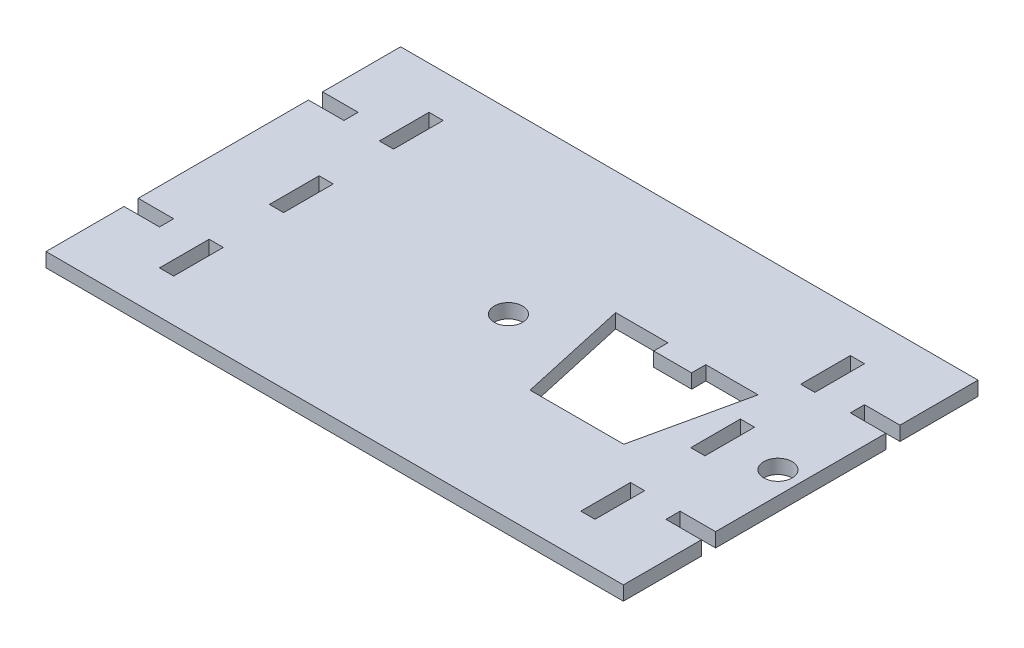
from build123d import *

# Parameters (mm, degrees)
SKETCH2_W           = 100
SKETCH2_H           = 50
BOSS_EXTRUDE1_DEPTH = 2
SKETCH12_W          = 9.8
SKETCH12_H          = 50
SKETCH12_W_2        = 8.8
CUT_EXTRUDE8_DEPTH  = 6
SKETCH13_W          = 2
SKETCH13_H          = 7
SKETCH13_W_2        = 5
SKETCH13_H_2        = 2
CUT_EXTRUDE10_DEPTH = 6
SKETCH14_R          = 2
CUT_EXTRUDE11_DEPTH = 2


with BuildPart() as part:
    # Sketch2 → Boss-Extrude1 (new body)
    with BuildSketch(Plane(origin=(0, 0, 0), x_dir=(1, 0, 0), z_dir=(0, 1, 0))):
        Rectangle(SKETCH2_W, SKETCH2_H)
    extrude(amount=BOSS_EXTRUDE1_DEPTH)

    # Sketch12 → Cut-Extrude8 (cut)
    with BuildSketch(Plane(origin=(0, 2, 0), x_dir=(1, 0, 0), z_dir=(0, 1, 0))):
        with Locations((-45.1, 0)):
            Rectangle(SKETCH12_W, SKETCH12_H)
        with Locations((45.6, 0)):
            Rectangle(SKETCH12_W_2, SKETCH12_H)
    extrude(amount=-CUT_EXTRUDE8_DEPTH, mode=Mode.SUBTRACT)

    # Sketch13 → Cut-Extrude10 (cut)
    with BuildSketch(Plane(origin=(0, 2, 0), x_dir=(1, 0, 0), z_dir=(0, 1, 0))):
        with Locations((-29.2, 15.5)):
            Rectangle(SKETCH13_W, SKETCH13_H)
        with Locations((-29.2, 0)):
            Rectangle(SKETCH13_W, SKETCH13_H)
        with Locations((-29.2, -15.5)):
            Rectangle(SKETCH13_W, SKETCH13_H)
        with Locations((30.2, 15.5)):
            Rectangle(SKETCH13_W, SKETCH13_H)
        with Locations((30.2, 0)):
            Rectangle(SKETCH13_W, SKETCH13_H)
        with Locations((30.2, -15.5)):
            Rectangle(SKETCH13_W, SKETCH13_H)
        with Locations((-37.7, 13)):
            Rectangle(SKETCH13_W_2, SKETCH13_H_2)
        with Locations((-37.7, -13)):
            Rectangle(SKETCH13_W_2, SKETCH13_H_2)
        with Locations((38.7, 13)):
            Rectangle(SKETCH13_W_2, SKETCH13_H_2)
        with Locations((38.7, -13)):
            Rectangle(SKETCH13_W_2, SKETCH13_H_2)
    extrude(amount=-CUT_EXTRUDE10_DEPTH, mode=Mode.SUBTRACT)

    # Sketch14 → Cut-Extrude11 (cut)
    with BuildSketch(Plane.XZ):
        Polygon((25.004318917, -5.7), (20.125716489, -5.7), (20.125716489, -7.7), (27.496267271, -7.7), (24.06, 7.8), (10.849660593, 7.8), (7.413393322, -7.7), (14.783944105, -7.7), (14.783944105, -5.7), (9.905341676, -5.7), (12.454830297, 5.8), (22.454830297, 5.8), align=None)
        Polygon((14.783944105, -5.7), (20.125716489, -5.7), (25.004318917, -5.7), (22.454830297, 5.8), (12.454830297, 5.8), (9.905341676, -5.7), align=None)
        with Locations(Location((0.046267271, 0.05, 0), (0, 0, 270))):
            Circle(SKETCH14_R)
        with Locations(Location((38.046267271, 0.05, 0), (0, 0, 270))):
            Circle(SKETCH14_R)
    extrude(amount=-CUT_EXTRUDE11_DEPTH, mode=Mode.SUBTRACT)


solid = part.part
